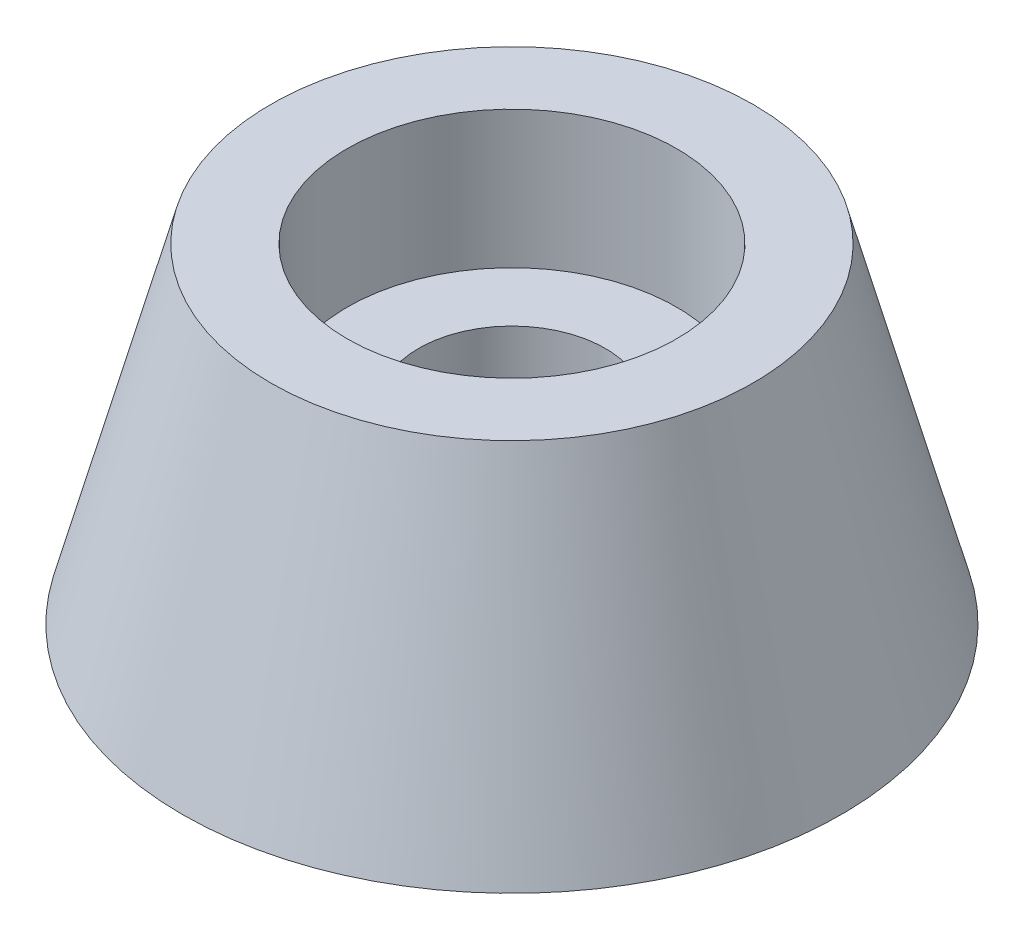
from build123d import *

# Parameters (mm, degrees)
ESQUISSE1_R             = 6
BOSS_EXTRU_1_DEPTH      = 6
BOSS_EXTRU_1_TAPER      = 15
ESQUISSE2_R             = 3
ENL_V_MAT_EXTRU_1_DEPTH = 2.5
D_GAGEMENT_M31_D        = 3.4


with BuildPart() as part:
    # Esquisse1 → Boss.-Extru.1 (new body)
    with BuildSketch(Plane(origin=(0, 0, 0), x_dir=(1, 0, 0), z_dir=(0, 1, 0))):
        Circle(ESQUISSE1_R)
    extrude(amount=BOSS_EXTRU_1_DEPTH, taper=BOSS_EXTRU_1_TAPER)

    # Esquisse2 → Enlèv. mat.-Extru.1 (cut)
    with BuildSketch(Plane(origin=(0, 6, 0), x_dir=(1, 0, 0), z_dir=(0, 1, 0))):
        with Locations(Location((0, 0, 0), (0, 0, 270))):
            Circle(ESQUISSE2_R)
    extrude(amount=-ENL_V_MAT_EXTRU_1_DEPTH, mode=Mode.SUBTRACT)

    # Dégagement M31 (through all)
    with Locations(Plane(origin=(0, 3.5, 0), x_dir=(1, 0, 0), z_dir=(0, 1, 0))):
        with Locations((0, 0)):
            Hole(D_GAGEMENT_M31_D / 2)


solid = part.part
